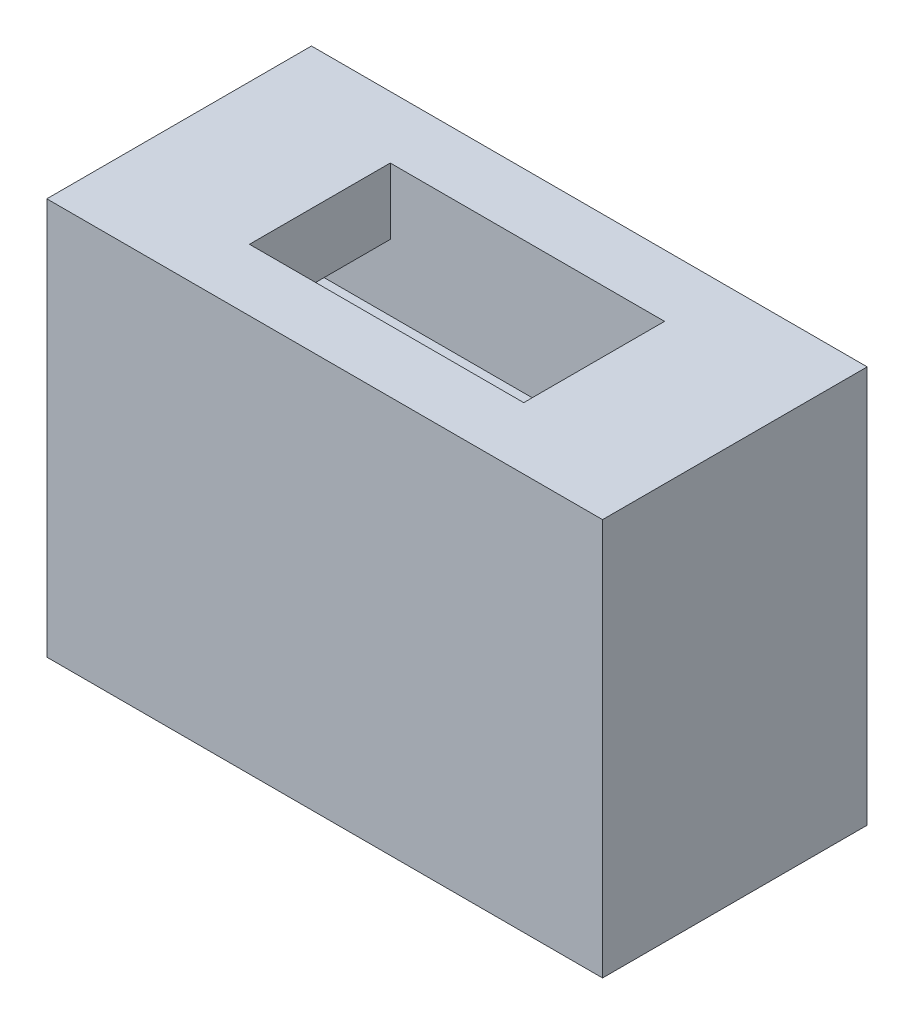
from build123d import *

# Parameters (mm, degrees)
ESQUISSE1_W             = 42
ESQUISSE1_H             = 20
BOSS_EXTRU_1_DEPTH      = 30
ESQUISSE2_W             = 20.729111418
ESQUISSE2_H             = 10.640304806
ENL_V_MAT_EXTRU_1_DEPTH = 10
ESQUISSE3_W             = 10.640304806
ESQUISSE3_H             = 5
ENL_V_MAT_EXTRU_2_DEPTH = 45.539144074


with BuildPart() as part:
    # Esquisse1 → Boss.-Extru.1 (new body)
    with BuildSketch(Plane(origin=(0, 0, 0), x_dir=(1, 0, 0), z_dir=(0, 1, 0))):
        Rectangle(ESQUISSE1_W, ESQUISSE1_H)
    extrude(amount=BOSS_EXTRU_1_DEPTH)

    # Esquisse2 → Enlèv. mat.-Extru.1 (cut)
    with BuildSketch(Plane(origin=(0, 30, 0), x_dir=(1, 0, 0), z_dir=(0, 1, 0))):
        Rectangle(ESQUISSE2_W, ESQUISSE2_H)
    extrude(amount=-ENL_V_MAT_EXTRU_1_DEPTH, mode=Mode.SUBTRACT)

    # Esquisse3 → Enlèv. mat.-Extru.2 (cut, through all)
    with BuildSketch(Plane(origin=(-10.364555709, 0, 0), x_dir=(0, 0, -1), z_dir=(1, 0, 0))):
        with Locations((0, 22.5)):
            Rectangle(ESQUISSE3_W, ESQUISSE3_H)
    extrude(amount=-ENL_V_MAT_EXTRU_2_DEPTH, mode=Mode.SUBTRACT)


solid = part.part
